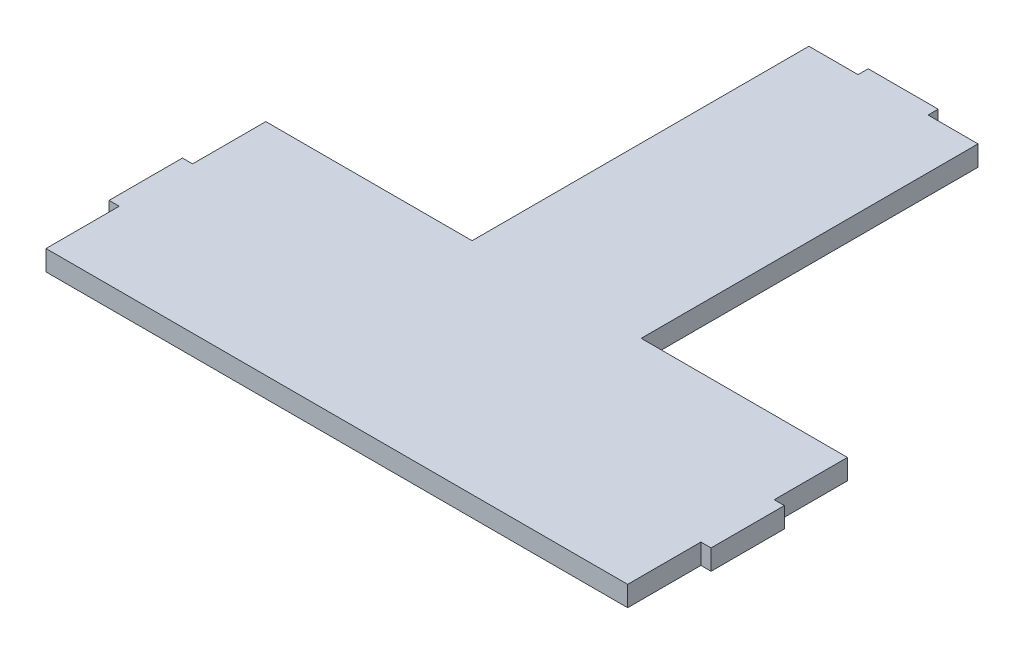
from build123d import *

# Parameters (mm, degrees)
BOSS_EXTRUDE1_DEPTH = 6


with BuildPart() as part:
    # Sketch1 → Boss-Extrude1 (new body)
    with BuildSketch(Plane(origin=(0, 0, 0), x_dir=(1, 0, 0), z_dir=(0, 1, 0))):
        Polygon((50, -48.639618138), (50, 50.960381862), (35.229078932, 50.960381862), (35.229078932, 53.960381862), (14.533108064, 53.960381862), (14.533108064, 50.960381862), (0, 50.960381862), (0, -48.639618138), (-61, -48.639618138), (-61, -70.299618138), (-64, -70.299618138), (-64, -91.979618138), (-61, -91.979618138), (-61, -113.639618138), (111, -113.639618138), (111, -91.979618138), (114, -91.979618138), (114, -70.299618138), (111, -70.299618138), (111, -48.639618138), align=None)
    extrude(amount=BOSS_EXTRUDE1_DEPTH)


solid = part.part
